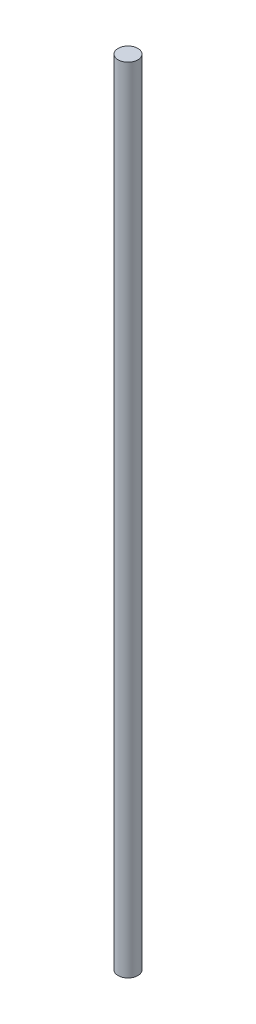
from build123d import *

# Parameters (mm, degrees)
SKETCH1_R           = 3.175
BOSS_EXTRUDE1_DEPTH = 254


with BuildPart() as part:
    # Sketch1 → Boss-Extrude1 (new body)
    with BuildSketch(Plane(origin=(0, 0, 0), x_dir=(1, 0, 0), z_dir=(0, 1, 0))):
        with Locations(Location((0, 0, 0), (0, 0, 270))):
            Circle(SKETCH1_R)
    extrude(amount=BOSS_EXTRUDE1_DEPTH)


solid = part.part
